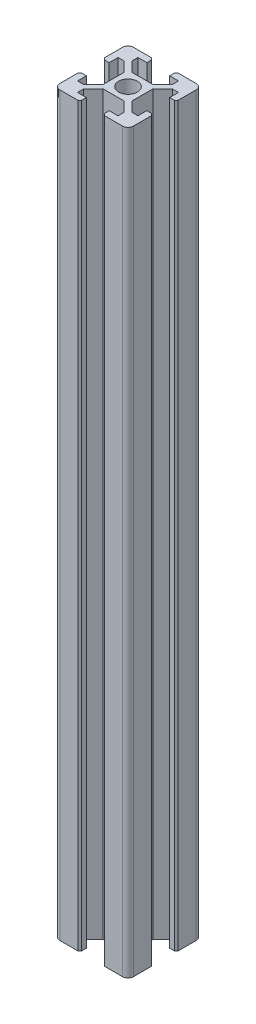
from build123d import *

# Parameters (mm, degrees)
EXTRUDE_2_DEPTH     = 200
SKETCH_4_R          = 2.55
CUT_EXTRUDE_2_DEPTH = 202.990098767


with BuildPart() as part:
    # 草图1 → 凸台-拉伸2 (new body)
    with BuildSketch(Plane(origin=(0, 0, 0), x_dir=(1, 0, 0), z_dir=(0, 1, 0))):
        with BuildLine():
            Line((13.9, 12.839339828), (13.9, 7.160660172))
            Line((13.9, 7.160660172), (16.560660172, 4.5))
            Line((16.560660172, 4.5), (18.2, 4.5))
            Line((18.2, 4.5), (18.2, 6.9))
            Line((18.2, 6.9), (19.5, 6.9))
            Line((19.5, 6.9), (20, 6.4))
            Line((20, 6.4), (20, 1.5))
            ThreePointArc((20, 1.5), (19.560660172, 0.439339828), (18.5, 0))
            Line((18.5, 0), (13.6, 0))
            Line((13.6, 0), (13.1, 0.5))
            Line((13.1, 0.5), (13.1, 1.8))
            Line((13.1, 1.8), (15.5, 1.8))
            Line((15.5, 1.8), (15.5, 3.439339828))
            Line((15.5, 3.439339828), (12.839339828, 6.1))
            Line((12.839339828, 6.1), (7.160660172, 6.1))
            Line((7.160660172, 6.1), (4.5, 3.439339828))
            Line((4.5, 3.439339828), (4.5, 1.8))
            Line((4.5, 1.8), (6.9, 1.8))
            Line((6.9, 1.8), (6.9, 0.5))
            Line((6.9, 0.5), (6.4, 0))
            Line((6.4, 0), (1.5, 0))
            ThreePointArc((1.5, 0), (0.439339828, 0.439339828), (0, 1.5))
            Line((0, 1.5), (0, 6.4))
            Line((0, 6.4), (0.5, 6.9))
            Line((0.5, 6.9), (1.8, 6.9))
            Line((1.8, 6.9), (1.8, 4.5))
            Line((1.8, 4.5), (3.439339828, 4.5))
            Line((3.439339828, 4.5), (6.1, 7.160660172))
            Line((6.1, 7.160660172), (6.1, 12.839339828))
            Line((6.1, 12.839339828), (3.439339828, 15.5))
            Line((3.439339828, 15.5), (1.8, 15.5))
            Line((1.8, 15.5), (1.8, 13.1))
            Line((1.8, 13.1), (0.5, 13.1))
            Line((0.5, 13.1), (0, 13.6))
            Line((0, 13.6), (0, 18.5))
            ThreePointArc((0, 18.5), (0.439339828, 19.560660172), (1.5, 20))
            Line((1.5, 20), (6.4, 20))
            Line((6.4, 20), (6.9, 19.5))
            Line((6.9, 19.5), (6.9, 18.2))
            Line((6.9, 18.2), (4.5, 18.2))
            Line((4.5, 18.2), (4.5, 16.560660172))
            Line((4.5, 16.560660172), (7.160660172, 13.9))
            Line((7.160660172, 13.9), (12.839339828, 13.9))
            Line((12.839339828, 13.9), (15.5, 16.560660172))
            Line((15.5, 16.560660172), (15.5, 18.2))
            Line((15.5, 18.2), (13.1, 18.2))
            Line((13.1, 18.2), (13.1, 19.5))
            Line((13.1, 19.5), (13.6, 20))
            Line((13.6, 20), (18.5, 20))
            ThreePointArc((18.5, 20), (19.560660172, 19.560660172), (20, 18.5))
            Line((20, 18.5), (20, 13.6))
            Line((20, 13.6), (19.5, 13.1))
            Line((19.5, 13.1), (18.2, 13.1))
            Line((18.2, 13.1), (18.2, 15.5))
            Line((18.2, 15.5), (16.560660172, 15.5))
            Line((16.560660172, 15.5), (13.9, 12.839339828))
        make_face()
    extrude(amount=EXTRUDE_2_DEPTH)

    # 草图4 → 切除-拉伸2 (cut, through all)
    with BuildSketch(Plane.XZ):
        with Locations(Location((10, -10, 0), (0, 0, 270))):
            Circle(SKETCH_4_R)
    extrude(amount=-CUT_EXTRUDE_2_DEPTH, mode=Mode.SUBTRACT)


solid = part.part
